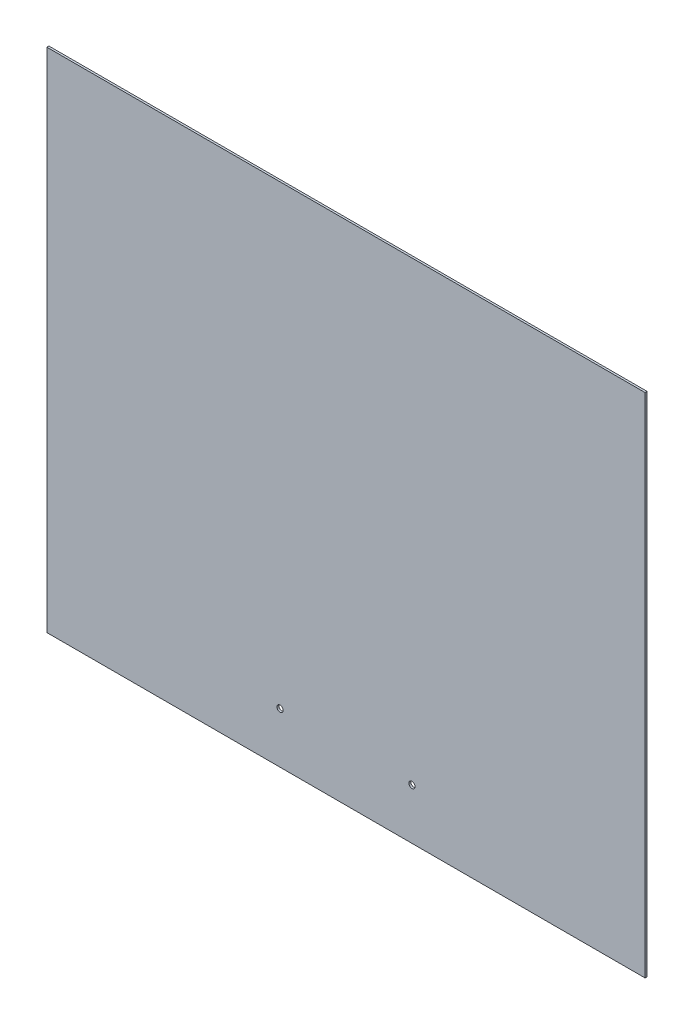
from build123d import *

# Parameters (mm, degrees)
SKETCH1_W           = 590
SKETCH1_H           = 500
BOSS_EXTRUDE1_DEPTH = 2
SKETCH2_R           = 3.1
CUT_EXTRUDE1_DEPTH  = 774.371838122


with BuildPart() as part:
    # Sketch1 → Boss-Extrude1 (new body)
    with BuildSketch(Plane.XY):
        with Locations((295, -250)):
            Rectangle(SKETCH1_W, SKETCH1_H)
    extrude(amount=BOSS_EXTRUDE1_DEPTH)

    # Sketch2 → Cut-Extrude1 (cut, through all)
    with BuildSketch(Plane.XY.offset(2)):
        with Locations((230, -450)):
            Circle(SKETCH2_R)
        with Locations((360, -450)):
            Circle(SKETCH2_R)
    extrude(amount=-CUT_EXTRUDE1_DEPTH, mode=Mode.SUBTRACT)


solid = part.part
